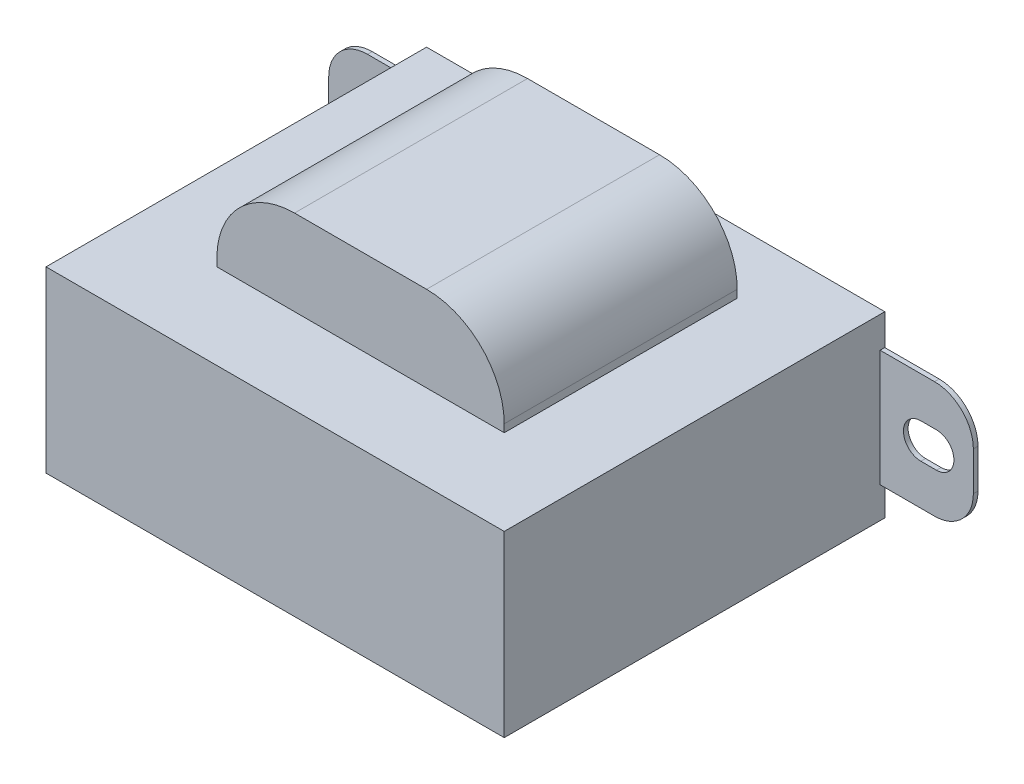
from build123d import *

# Parameters (mm, degrees)
SKETCH_1_W      = 59
SKETCH_1_H      = 23
EXTRUDE_1_DEPTH = 49
EXTRUDE_START   = -11
EXTRUDE_2_DEPTH = 30
EXTRUDE_3_DEPTH = 0.6


with BuildPart() as part:
    # 草图1 → 拉伸1 (new body)
    with BuildSketch(Plane.XY):
        Rectangle(SKETCH_1_W, SKETCH_1_H)
    extrude(amount=EXTRUDE_1_DEPTH)

    # 草图2 → 拉伸2 (add)
    with BuildSketch(Plane.XY.offset(49).offset(EXTRUDE_START)):
        with BuildLine():
            Line((-8.5, 22.5), (8.5, 22.5))
            ThreePointArc((8.5, 22.5), (15.571067812, 19.571067812), (18.5, 12.5))
            Line((18.5, 12.5), (18.5, -12.5))
            ThreePointArc((18.5, -12.5), (15.571067812, -19.571067812), (8.5, -22.5))
            Line((8.5, -22.5), (-8.5, -22.5))
            ThreePointArc((-8.5, -22.5), (-15.571067812, -19.571067812), (-18.5, -12.5))
            Line((-18.5, -12.5), (-18.5, 12.5))
            ThreePointArc((-18.5, 12.5), (-15.571067812, 19.571067812), (-8.5, 22.5))
        make_face()
    extrude(amount=-EXTRUDE_2_DEPTH)

    # 草图3 → 拉伸3 (add)
    # profile 1 of 2: a face of its own
    with BuildSketch(Plane(origin=(0, 0, 0), x_dir=(-1, 0, 0), z_dir=(0, 0, -1))):
        with BuildLine():
            Line((-29.5, 7.5), (-36.5, 7.5))
            ThreePointArc((-36.5, 7.5), (-40.035533906, 6.035533906), (-41.5, 2.5))
            Line((-41.5, 2.5), (-41.5, -2.5))
            ThreePointArc((-41.5, -2.5), (-40.035533906, -6.035533906), (-36.5, -7.5))
            Line((-36.5, -7.5), (-29.5, -7.5))
            Line((-29.5, -7.5), (-29.5, 7.5))
        make_face()
        with BuildLine():
            Line((-36.75, 2.25), (-34.75, 2.25))
            ThreePointArc((-34.75, 2.25), (-32.5, 0), (-34.75, -2.25))
            Line((-34.75, -2.25), (-36.75, -2.25))
            ThreePointArc((-36.75, -2.25), (-39, 0), (-36.75, 2.25))
        make_face(mode=Mode.SUBTRACT)
    # profile 2 of 2: a face of its own
    with BuildSketch(Plane(origin=(0, 0, 0), x_dir=(-1, 0, 0), z_dir=(0, 0, -1))):
        with BuildLine():
            Line((41.5, 2.5), (41.5, -2.5))
            ThreePointArc((41.5, -2.5), (40.035533906, -6.035533906), (36.5, -7.5))
            Line((36.5, -7.5), (29.5, -7.5))
            Line((29.5, -7.5), (29.5, 7.5))
            Line((29.5, 7.5), (36.5, 7.5))
            ThreePointArc((36.5, 7.5), (40.035533906, 6.035533906), (41.5, 2.5))
        make_face()
        with BuildLine():
            Line((36.75, 2.25), (34.75, 2.25))
            ThreePointArc((34.75, 2.25), (32.5, 0), (34.75, -2.25))
            Line((34.75, -2.25), (36.75, -2.25))
            ThreePointArc((36.75, -2.25), (39, 0), (36.75, 2.25))
        make_face(mode=Mode.SUBTRACT)
    extrude(amount=-EXTRUDE_3_DEPTH)


solid = part.part
